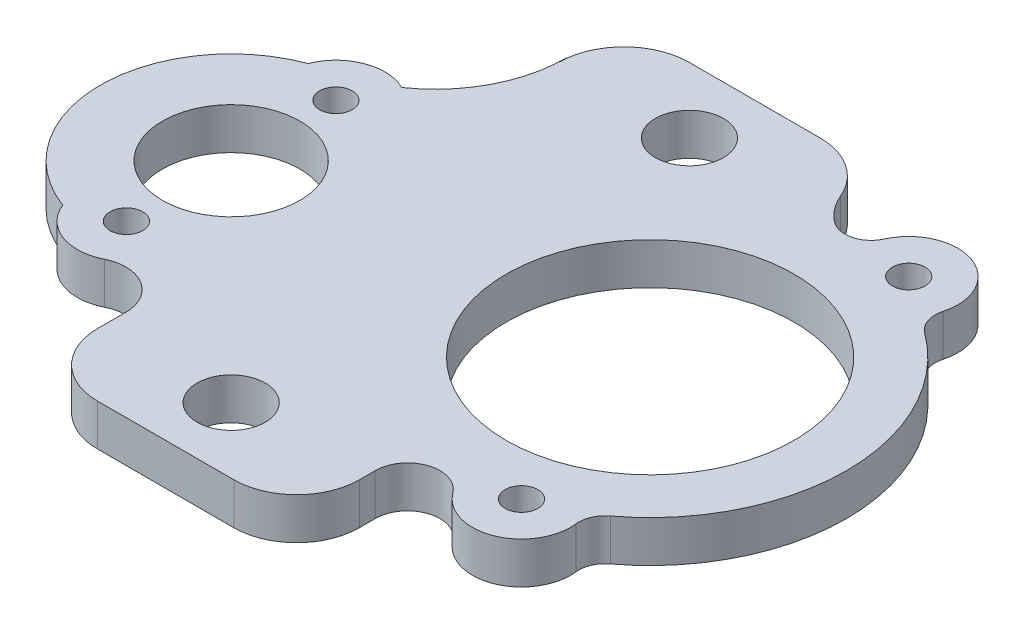
from build123d import *

# Parameters (mm, degrees)
BOSS_EXTRUDE1_DEPTH          = 3.175
CUT_EXTRUDE1_START           = -3.175
CUT_EXTRUDE1_DEPTH           = 3.175
F_2_5_2_5_DIAMETER_HOLE1_D   = 2.5
F_22_0_22_DIAMETER_HOLE1_D   = 22
F_10_5_10_5_DIAMETER_HOLE1_D = 10.5
F_5_2_5_2_DIAMETER_HOLE1_D   = 5.2


with BuildPart() as part:
    # Sketch1 → Boss-Extrude1 (new body)
    with BuildSketch(Plane(origin=(0, 73.175, 0), x_dir=(1, 0, 0), z_dir=(0, 1, 0))):
        with BuildLine():
            Line((15, -131.043137062), (-1.022023545, -131.043137062))
            ThreePointArc((-1.022023545, -131.043137062), (-0.325892642, -137.979342107), (-4.330946321, -143.685048347))
            ThreePointArc((-4.330946321, -143.685048347), (-7.347711019, -143.543683532), (-9.490358424, -145.672043312))
            ThreePointArc((-9.490358424, -145.672043312), (-16, -155.043137062), (-9.490358424, -164.414230812))
            ThreePointArc((-9.490358424, -164.414230812), (-7.347711019, -166.542590592), (-4.330946321, -166.401225777))
            ThreePointArc((-4.330946321, -166.401225777), (-1.426295687, -166.532567239), (0, -169.066324625))
            Line((0, -169.066324625), (0, -171.243137062))
            ThreePointArc((0, -171.243137062), (1.40588745, -174.637249612), (4.8, -176.043137062))
            Line((4.8, -176.043137062), (15.2, -176.043137062))
            ThreePointArc((15.2, -176.043137062), (18.59411255, -174.637249612), (20, -171.243137062))
            Line((20, -171.243137062), (20, -170.064478312))
            ThreePointArc((20, -170.064478312), (21.68082981, -167.69523564), (24.452536205, -168.564800671))
            ThreePointArc((24.452536205, -168.564800671), (28.846907451, -169.817736591), (31.189498771, -165.894394524))
            ThreePointArc((31.189498771, -165.894394524), (31.338525975, -164.871140606), (31.978698654, -164.05908357))
            ThreePointArc((31.978698654, -164.05908357), (37.999904187, -151.989523925), (31.892574785, -139.963314477))
            ThreePointArc((31.892574785, -139.963314477), (31.188720102, -139.008164704), (31.149849359, -137.822326786))
            ThreePointArc((31.149849359, -137.822326786), (28.808294112, -133.301045501), (24.117695109, -135.281738919))
            ThreePointArc((24.117695109, -135.281738919), (22.762301061, -136.401892346), (21.046177665, -136.018803304))
            ThreePointArc((21.046177665, -136.018803304), (20.21083435, -135.158715929), (19.614707675, -134.118436286))
            ThreePointArc((19.614707675, -134.118436286), (17.772769024, -131.882397712), (15, -131.043137062))
        make_face()
    extrude(amount=-BOSS_EXTRUDE1_DEPTH)

    # Sketch2 → Cut-Extrude1 (cut)
    with BuildSketch(Plane.XZ.offset(-70).offset(CUT_EXTRUDE1_START)):
        with BuildLine():
            Line((0, 136.043137062), (0, 135.44721912))
            ThreePointArc((0, 135.44721912), (-0.258856213, 133.18666217), (-1.022023545, 131.043137062))
            Line((-1.022023545, 131.043137062), (5, 131.043137062))
            ThreePointArc((5, 131.043137062), (1.464466094, 132.507603156), (0, 136.043137062))
        make_face()
    extrude(amount=CUT_EXTRUDE1_DEPTH, mode=Mode.SUBTRACT)

    # Ø2.5 (2.5) Diameter Hole1 (through all)
    with Locations(Plane(origin=(0, 73.175, 0), x_dir=(1, 0, 0), z_dir=(0, 1, 0))):
        with Locations((27.534095489, -136.827930511), (27.465074328, -166.331615936), (-6, -147.043137062), (-6, -163.043137062)):
            Hole(F_2_5_2_5_DIAMETER_HOLE1_D / 2)

    # Ø22.0 (22) Diameter Hole1 (through all)
    with Locations(Plane(origin=(0, 73.175, 0), x_dir=(1, 0, 0), z_dir=(0, 1, 0))):
        with Locations((23, -152.043137062)):
            Hole(F_22_0_22_DIAMETER_HOLE1_D / 2)

    # Ø10.5 (10.5) Diameter Hole1 (through all)
    with Locations(Plane(origin=(0, 73.175, 0), x_dir=(1, 0, 0), z_dir=(0, 1, 0))):
        with Locations((-6, -155.043137062)):
            Hole(F_10_5_10_5_DIAMETER_HOLE1_D / 2)

    # Ø5.2 (5.2) Diameter Hole1 (through all)
    with Locations(Plane(origin=(0, 73.175, 0), x_dir=(1, 0, 0), z_dir=(0, 1, 0))):
        with Locations((10, -171.043137062), (10, -136.043137062)):
            Hole(F_5_2_5_2_DIAMETER_HOLE1_D / 2)


solid = part.part
